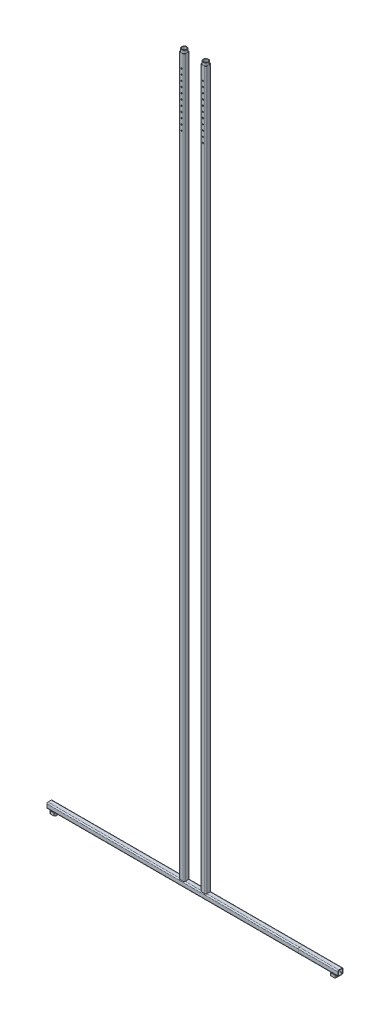
from build123d import *

# Parameters (mm, degrees)
SQUARE_TUBE_20_X_20_X_2_1_DEPTH   = 2660
SQUARE_TUBE_20_X_20_X_2_1_2_DEPTH = 2660
SQUARE_TUBE_20_X_20_X_2_2_DEPTH   = 146
SQUARE_TUBE_20_X_20_X_2_2_2_DEPTH = 934
SQUARE_TUBE_20_X_20_X_2_4_DEPTH   = 10
SQUARE_TUBE_20_X_20_X_2_4_2_DEPTH = 10
SKETCH14_R                        = 2.5
CUT_EXTRUDE1_DEPTH                = 2188.809610707
LPATTERN1_COUNT                   = 11
LPATTERN1_PITCH                   = 20
SKETCH15_R                        = 2.5
CUT_EXTRUDE2_DEPTH                = 2188.809610707
LPATTERN2_COUNT                   = 11
LPATTERN2_PITCH                   = 20
SKETCH16_R                        = 10
SKETCH16_R_2                      = 8
BOSS_EXTRUDE1_DEPTH               = 10
SKETCH18_R                        = 9.941903213
SKETCH18_R_2                      = 8.015816656
BOSS_EXTRUDE2_DEPTH               = 10


with BuildPart() as part:
    # Sketch1 → Square tube 20 X 20 X 2(1) (new body)
    with BuildSketch(Plane(origin=(385.446107784, 689.476047904, 0), x_dir=(1, 0, 0), z_dir=(0, -1, 0))):
        with BuildLine():
            Line((-6, -10), (6, -10))
            ThreePointArc((6, -10), (8.828427125, -8.828427125), (10, -6))
            Line((10, -6), (10, 6))
            ThreePointArc((10, 6), (8.828427125, 8.828427125), (6, 10))
            Line((6, 10), (-6, 10))
            ThreePointArc((-6, 10), (-8.828427125, 8.828427125), (-10, 6))
            Line((-10, 6), (-10, -6))
            ThreePointArc((-10, -6), (-8.828427125, -8.828427125), (-6, -10))
        make_face()
        with BuildLine():
            Line((-6, -8), (6, -8))
            ThreePointArc((6, -8), (7.414213562, -7.414213562), (8, -6))
            Line((8, -6), (8, 6))
            ThreePointArc((8, 6), (7.414213562, 7.414213562), (6, 8))
            Line((6, 8), (-6, 8))
            ThreePointArc((-6, 8), (-7.414213562, 7.414213562), (-8, 6))
            Line((-8, 6), (-8, -6))
            ThreePointArc((-8, -6), (-7.414213562, -7.414213562), (-6, -8))
        make_face(mode=Mode.SUBTRACT)
    extrude(amount=SQUARE_TUBE_20_X_20_X_2_1_DEPTH)

    # Sketch14 → Cut-Extrude1 (cut, symmetric)
    with BuildSketch(Plane(origin=(0, 0, -10), x_dir=(-1, 0, 0), z_dir=(0, 0, -1))):
        with Locations(Location((-384.847064026, 639.476047904, 0), (0, 0, 180))):
            Circle(SKETCH14_R)
    cut_extrude1 = extrude(amount=CUT_EXTRUDE1_DEPTH, both=True, mode=Mode.SUBTRACT)

    # LPattern1: Cut-Extrude1 ×11
    with Locations(*[(0, -i * LPATTERN1_PITCH, 0) for i in range(1, LPATTERN1_COUNT)]):
        add(cut_extrude1, mode=Mode.SUBTRACT)


with BuildPart() as body_2:
    # Sketch1 on segment 2 (carried to segment 2) → Square tube 20 X 20 X 2_1 2 (new body)
    with BuildSketch(Plane(origin=(305.446107784, 689.476047904, 0), x_dir=(1, 0, 0), z_dir=(0, -1, 0))):
        with BuildLine():
            Line((-6, -10), (6, -10))
            ThreePointArc((6, -10), (8.828427125, -8.828427125), (10, -6))
            Line((10, -6), (10, 6))
            ThreePointArc((10, 6), (8.828427125, 8.828427125), (6, 10))
            Line((6, 10), (-6, 10))
            ThreePointArc((-6, 10), (-8.828427125, 8.828427125), (-10, 6))
            Line((-10, 6), (-10, -6))
            ThreePointArc((-10, -6), (-8.828427125, -8.828427125), (-6, -10))
        make_face()
        with BuildLine():
            Line((-6, -8), (6, -8))
            ThreePointArc((6, -8), (7.414213562, -7.414213562), (8, -6))
            Line((8, -6), (8, 6))
            ThreePointArc((8, 6), (7.414213562, 7.414213562), (6, 8))
            Line((6, 8), (-6, 8))
            ThreePointArc((-6, 8), (-7.414213562, 7.414213562), (-8, 6))
            Line((-8, 6), (-8, -6))
            ThreePointArc((-8, -6), (-7.414213562, -7.414213562), (-6, -8))
        make_face(mode=Mode.SUBTRACT)
    extrude(amount=SQUARE_TUBE_20_X_20_X_2_1_2_DEPTH)

    # Sketch15 → Cut-Extrude2 (cut, symmetric)
    with BuildSketch(Plane(origin=(0, 0, -10), x_dir=(-1, 0, 0), z_dir=(0, 0, -1))):
        with Locations(Location((-305.446107784, 639.476047904, 0), (0, 0, 180))):
            Circle(SKETCH15_R)
    cut_extrude2 = extrude(amount=CUT_EXTRUDE2_DEPTH, both=True, mode=Mode.SUBTRACT)

    # LPattern2: Cut-Extrude2 ×11
    with Locations(*[(0, -i * LPATTERN2_PITCH, 0) for i in range(1, LPATTERN2_COUNT)]):
        add(cut_extrude2, mode=Mode.SUBTRACT)


with BuildPart() as body_3:
    # Sketch11 → Square tube 20 X 20 X 2(2) (new body)
    with BuildSketch(Plane(origin=(739.446107784, -1980.523952096, 0), x_dir=(0, -1, 0), z_dir=(-1, 0, 0))):
        with BuildLine():
            Line((-6, -10), (6, -10))
            ThreePointArc((6, -10), (8.828427125, -8.828427125), (10, -6))
            Line((10, -6), (10, 6))
            ThreePointArc((10, 6), (8.828427125, 8.828427125), (6, 10))
            Line((6, 10), (-6, 10))
            ThreePointArc((-6, 10), (-8.828427125, 8.828427125), (-10, 6))
            Line((-10, 6), (-10, -6))
            ThreePointArc((-10, -6), (-8.828427125, -8.828427125), (-6, -10))
        make_face()
        with BuildLine():
            Line((-6, -8), (6, -8))
            ThreePointArc((6, -8), (7.414213562, -7.414213562), (8, -6))
            Line((8, -6), (8, 6))
            ThreePointArc((8, 6), (7.414213562, 7.414213562), (6, 8))
            Line((6, 8), (-6, 8))
            ThreePointArc((-6, 8), (-7.414213562, 7.414213562), (-8, 6))
            Line((-8, 6), (-8, -6))
            ThreePointArc((-8, -6), (-7.414213562, -7.414213562), (-6, -8))
        make_face(mode=Mode.SUBTRACT)
    extrude(amount=-SQUARE_TUBE_20_X_20_X_2_2_DEPTH)


with BuildPart() as body_4:
    # Sketch11 on segment 2 (carried to segment 2) → Square tube 20 X 20 X 2_2 2 (new body)
    with BuildSketch(Plane(origin=(739.446107784, -1980.523952096, 0), x_dir=(0, -1, 0), z_dir=(-1, 0, 0))):
        with BuildLine():
            Line((-6, -10), (6, -10))
            ThreePointArc((6, -10), (8.828427125, -8.828427125), (10, -6))
            Line((10, -6), (10, 6))
            ThreePointArc((10, 6), (8.828427125, 8.828427125), (6, 10))
            Line((6, 10), (-6, 10))
            ThreePointArc((-6, 10), (-8.828427125, 8.828427125), (-10, 6))
            Line((-10, 6), (-10, -6))
            ThreePointArc((-10, -6), (-8.828427125, -8.828427125), (-6, -10))
        make_face()
        with BuildLine():
            Line((-6, -8), (6, -8))
            ThreePointArc((6, -8), (7.414213562, -7.414213562), (8, -6))
            Line((8, -6), (8, 6))
            ThreePointArc((8, 6), (7.414213562, 7.414213562), (6, 8))
            Line((6, 8), (-6, 8))
            ThreePointArc((-6, 8), (-7.414213562, 7.414213562), (-8, 6))
            Line((-8, 6), (-8, -6))
            ThreePointArc((-8, -6), (-7.414213562, -7.414213562), (-6, -8))
        make_face(mode=Mode.SUBTRACT)
    extrude(amount=SQUARE_TUBE_20_X_20_X_2_2_2_DEPTH)


with BuildPart() as body_5:
    # Sketch13 → Square tube 20 X 20 X 2(4) (new body)
    with BuildSketch(Plane(origin=(-174.553892216, -1990.523952096, 0), x_dir=(1, 0, 0), z_dir=(0, -1, 0))):
        with BuildLine():
            Line((-6, -10), (6, -10))
            ThreePointArc((6, -10), (8.828427125, -8.828427125), (10, -6))
            Line((10, -6), (10, 6))
            ThreePointArc((10, 6), (8.828427125, 8.828427125), (6, 10))
            Line((6, 10), (-6, 10))
            ThreePointArc((-6, 10), (-8.828427125, 8.828427125), (-10, 6))
            Line((-10, 6), (-10, -6))
            ThreePointArc((-10, -6), (-8.828427125, -8.828427125), (-6, -10))
        make_face()
        with BuildLine():
            Line((-6, -8), (6, -8))
            ThreePointArc((6, -8), (7.414213562, -7.414213562), (8, -6))
            Line((8, -6), (8, 6))
            ThreePointArc((8, 6), (7.414213562, 7.414213562), (6, 8))
            Line((6, 8), (-6, 8))
            ThreePointArc((-6, 8), (-7.414213562, 7.414213562), (-8, 6))
            Line((-8, 6), (-8, -6))
            ThreePointArc((-8, -6), (-7.414213562, -7.414213562), (-6, -8))
        make_face(mode=Mode.SUBTRACT)
    extrude(amount=SQUARE_TUBE_20_X_20_X_2_4_DEPTH)


with BuildPart() as body_6:
    # Sketch13 on segment 2 (carried to segment 2) → Square tube 20 X 20 X 2_4 2 (new body)
    with BuildSketch(Plane(origin=(865.446107784, -1990.523952096, 0), x_dir=(1, 0, 0), z_dir=(0, -1, 0))):
        with BuildLine():
            Line((-6, -10), (6, -10))
            ThreePointArc((6, -10), (8.828427125, -8.828427125), (10, -6))
            Line((10, -6), (10, 6))
            ThreePointArc((10, 6), (8.828427125, 8.828427125), (6, 10))
            Line((6, 10), (-6, 10))
            ThreePointArc((-6, 10), (-8.828427125, 8.828427125), (-10, 6))
            Line((-10, 6), (-10, -6))
            ThreePointArc((-10, -6), (-8.828427125, -8.828427125), (-6, -10))
        make_face()
        with BuildLine():
            Line((-6, -8), (6, -8))
            ThreePointArc((6, -8), (7.414213562, -7.414213562), (8, -6))
            Line((8, -6), (8, 6))
            ThreePointArc((8, 6), (7.414213562, 7.414213562), (6, 8))
            Line((6, 8), (-6, 8))
            ThreePointArc((-6, 8), (-7.414213562, 7.414213562), (-8, 6))
            Line((-8, 6), (-8, -6))
            ThreePointArc((-8, -6), (-7.414213562, -7.414213562), (-6, -8))
        make_face(mode=Mode.SUBTRACT)
    extrude(amount=SQUARE_TUBE_20_X_20_X_2_4_2_DEPTH)


with BuildPart() as body_7:
    # Sketch16 → Boss-Extrude1 (new body)
    with BuildSketch(Plane(origin=(0, 689.476047904, 0), x_dir=(1, 0, 0), z_dir=(0, 1, 0))):
        with Locations(Location((385.446107784, 0, 0), (0, 0, 180))):
            Circle(SKETCH16_R)
        with Locations(Location((385.446107784, 0, 0), (0, 0, 180))):
            Circle(SKETCH16_R_2, mode=Mode.SUBTRACT)
    extrude(amount=BOSS_EXTRUDE1_DEPTH)


with BuildPart() as body_8:
    # Sketch18 → Boss-Extrude2 (new body)
    with BuildSketch(Plane(origin=(0, 689.476047904, 0), x_dir=(1, 0, 0), z_dir=(0, 1, 0))):
        with Locations(Location((305.387800045, 0.015816656, 0), (0, 0, 180))):
            Circle(SKETCH18_R)
        with Locations(Location((305.387800045, 0.015816656, 0), (0, 0, 180))):
            Circle(SKETCH18_R_2, mode=Mode.SUBTRACT)
    extrude(amount=BOSS_EXTRUDE2_DEPTH)


solid = Compound([part.part, body_2.part, body_3.part, body_4.part, body_5.part, body_6.part, body_7.part, body_8.part])
